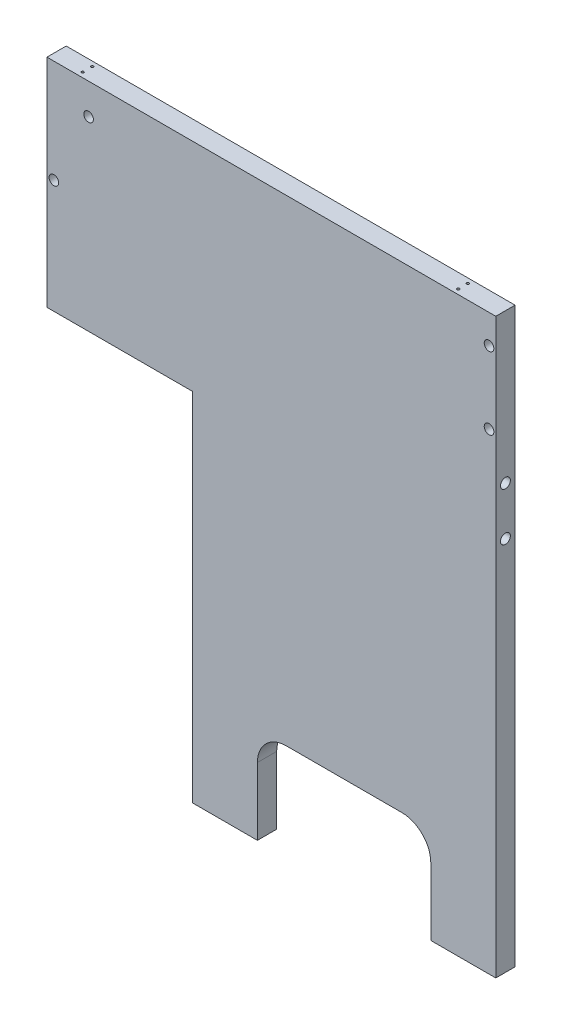
from build123d import *

# Parameters (mm, degrees)
EXTRUDE_1_DEPTH     = 20
SKETCH_2_R          = 5
CUT_EXTRUDE_1_DEPTH = 757.029761319
SKETCH_3_R          = 5.15
CUT_EXTRUDE_2_DEPTH = 20
CUT_EXTRUDE_START   = -20
SKETCH_4_R          = 5.15
CUT_EXTRUDE_3_DEPTH = 20
SKETCH_5_R          = 1.25
CUT_EXTRUDE_4_DEPTH = 10


with BuildPart() as part:
    # 草图1 → 凸台-拉伸1 (new body)
    with BuildSketch(Plane.XY):
        Polygon((0, 0), (466, 0), (466, -595), (151, -595), (151, -225), (0, -225), align=None)
    extrude(amount=-EXTRUDE_1_DEPTH)

    # 草图2 → 切除-拉伸1 (cut, through all)
    with BuildSketch(Plane.XY):
        with Locations((43.2, -32)):
            Circle(SKETCH_2_R)
        with Locations((459, -30)):
            Circle(SKETCH_2_R)
        with Locations((459, -105)):
            Circle(SKETCH_2_R)
        with Locations((7.2, -107)):
            Circle(SKETCH_2_R)
        with BuildLine():
            Line((218.5, -595), (218.5, -525))
            ThreePointArc((218.5, -525), (227.286796564, -503.786796564), (248.5, -495))
            Line((248.5, -495), (368.5, -495))
            ThreePointArc((368.5, -495), (389.713203436, -503.786796564), (398.5, -525))
            Line((398.5, -525), (398.5, -595))
            Line((398.5, -595), (218.5, -595))
        make_face()
    extrude(amount=-CUT_EXTRUDE_1_DEPTH, mode=Mode.SUBTRACT)

    # 草图3 → 切除-拉伸2 (cut)
    with BuildSketch(Plane.ZY):
        with Locations((-10, -155)):
            Circle(SKETCH_3_R)
        with Locations((-10, -205)):
            Circle(SKETCH_3_R)
    extrude(amount=-CUT_EXTRUDE_2_DEPTH, mode=Mode.SUBTRACT)

    # 草图4 → 切除-拉伸3 (cut)
    with BuildSketch(Plane(origin=(466, 0, 0), x_dir=(0, 0, -1), z_dir=(1, 0, 0)).offset(CUT_EXTRUDE_START)):
        with Locations(Location((10, -155, 0), (0, 0, 180))):
            Circle(SKETCH_4_R)
        with Locations(Location((10, -205, 0), (0, 0, 180))):
            Circle(SKETCH_4_R)
    extrude(amount=CUT_EXTRUDE_3_DEPTH, mode=Mode.SUBTRACT)

    # 草图5 → 切除-拉伸4 (cut)
    with BuildSketch(Plane(origin=(0, 0, 0), x_dir=(1, 0, 0), z_dir=(0, 1, 0))):
        with Locations(Location((32, 15, 0), (0, 0, 270))):
            Circle(SKETCH_5_R)
        with Locations(Location((32, 5, 0), (0, 0, 270))):
            Circle(SKETCH_5_R)
        with Locations(Location((422, 15, 0), (0, 0, 270))):
            Circle(SKETCH_5_R)
        with Locations(Location((422, 5, 0), (0, 0, 270))):
            Circle(SKETCH_5_R)
    extrude(amount=-CUT_EXTRUDE_4_DEPTH, mode=Mode.SUBTRACT)


solid = part.part
